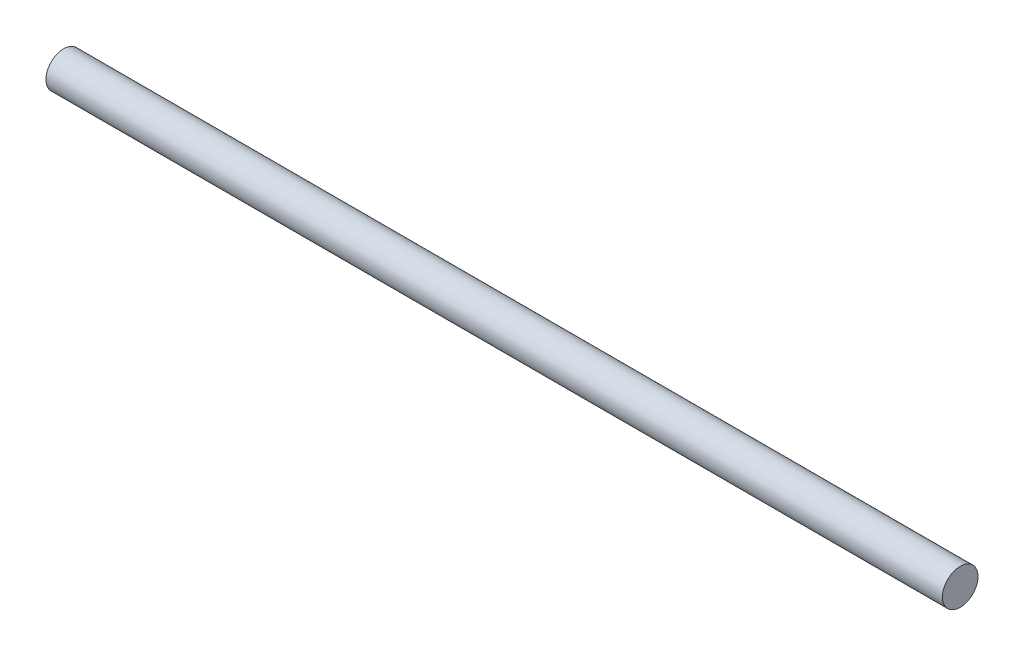
from build123d import *

# Parameters (mm, degrees)
SKETCH1_R           = 1.25
BOSS_EXTRUDE1_DEPTH = 63


with BuildPart() as part:
    # Sketch1 → Boss-Extrude1 (new body)
    with BuildSketch(Plane(origin=(0, 0, 0), x_dir=(0, 0, -1), z_dir=(1, 0, 0))):
        Circle(SKETCH1_R)
    extrude(amount=BOSS_EXTRUDE1_DEPTH)


solid = part.part
